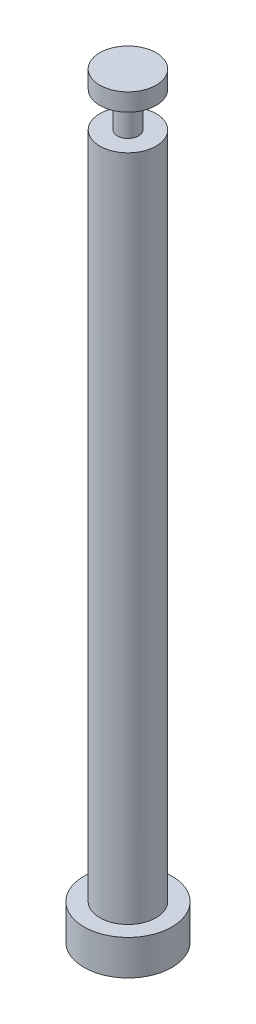
from build123d import *

# Parameters (mm, degrees)
SKETCH1_R           = 1.6
BOSS_EXTRUDE1_DEPTH = 43
SKETCH2_W           = 1
SKETCH2_H           = 2
SKETCH3_R           = 2.5
BOSS_EXTRUDE2_DEPTH = 2


with BuildPart() as part:
    # Sketch1 → Boss-Extrude1 (new body)
    with BuildSketch(Plane(origin=(0, 0, 0), x_dir=(1, 0, 0), z_dir=(0, 1, 0))):
        with Locations(Location((0, 0, 0), (0, 0, 270))):
            Circle(SKETCH1_R)
    extrude(amount=BOSS_EXTRUDE1_DEPTH)

    # Sketch2 → Cut-Revolve1 (revolve, cut)
    with BuildSketch(Plane.XY, mode=Mode.PRIVATE) as cut_revolve1_sk:
        with Locations((1.1, 41)):
            Rectangle(SKETCH2_W, SKETCH2_H)
    revolve(cut_revolve1_sk.sketch.rotate(Axis((0, 0, 0), (0, 1, 0)), 90), axis=Axis((0, 0, 0), (0, 1, 0)), mode=Mode.SUBTRACT)

    # Sketch3 → Boss-Extrude2 (add)
    with BuildSketch(Plane(origin=(0, 0, 0), x_dir=(1, 0, 0), z_dir=(0, 1, 0))):
        with Locations(Location((0, 0, 0), (0, 0, 270))):
            Circle(SKETCH3_R)
    extrude(amount=BOSS_EXTRUDE2_DEPTH)


solid = part.part
